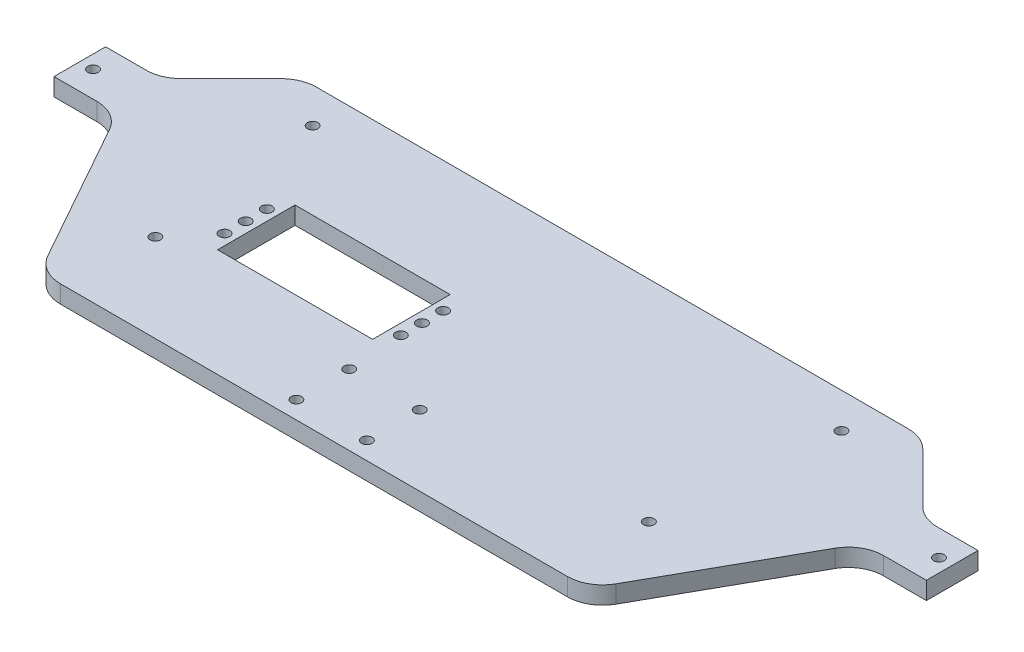
from build123d import *

# Parameters (mm, degrees)
SALIENTE_EXTRUIR1_DEPTH = 5
REDONDEO1_R             = 10
CROQUIS2_R              = 1.5
CROQUIS2_W              = 42
CROQUIS2_H              = 20
CORTAR_EXTRUIR1_DEPTH   = 135.669558943
CROQUIS3_W              = 4
CROQUIS3_H              = 14.636342218
CORTAR_EXTRUIR2_DEPTH   = 135.669558943
CROQUIS4_W              = 44
CROQUIS4_H              = 22
CORTAR_EXTRUIR3_DEPTH   = 131.881206084


with BuildPart() as part:
    # Croquis1 → Saliente-Extruir1 (new body)
    with BuildSketch(Plane(origin=(0, 0, 0), x_dir=(1, 0, 0), z_dir=(0, 1, 0))):
        Polygon((-88.1, 42.318171109), (88.1, 42.318171109), (108.1, 22.318171109), (127.75, 22.318171109), (127.75, 7.681828891), (105.75, 7.681828891), (77.75, -42.318171109), (-77.75, -42.318171109), (-105.75, 7.681828891), (-127.75, 7.681828891), (-127.75, 22.318171109), (-108.1, 22.318171109), align=None)
    extrude(amount=SALIENTE_EXTRUIR1_DEPTH)

    # Redondeo1
    redondeo1_edges = [part.edges().sort_by_distance(p)[0] for p in [
        (-88.1, 2.5, -42.318171109),
        (88.1, 2.5, -42.318171109),
        (108.1, 2.5, -22.318171109),
        (105.75, 2.5, -7.681828891),
        (77.75, 2.5, 42.318171109),
        (-77.75, 2.5, 42.318171109),
        (-105.75, 2.5, -7.681828891),
        (-108.1, 2.5, -22.318171109),
    ]]
    fillet(redondeo1_edges, radius=REDONDEO1_R)

    # Croquis2 → Cortar-Extruir1 (cut, through all)
    with BuildSketch(Plane(origin=(0, 5, 0), x_dir=(1, 0, 0), z_dir=(0, 1, 0))):
        with Locations(Location((70, -17.318171109, 0), (0, 0, 270))):
            Circle(CROQUIS2_R)
        with Locations(Location((-70, -17.318171109, 0), (0, 0, 270))):
            Circle(CROQUIS2_R)
        with Locations(Location((-119.996067812, 15, 0), (0, 0, 270))):
            Circle(CROQUIS2_R)
        with Locations(Location((119.996067812, 15, 0), (0, 0, 270))):
            Circle(CROQUIS2_R)
        with Locations(Location((-75, 32.318171109, 0), (0, 0, 270))):
            Circle(CROQUIS2_R)
        with Locations(Location((75, 32.318171109, 0), (0, 0, 270))):
            Circle(CROQUIS2_R)
        with Locations(Location((-10, -22.318171109, 0), (0, 0, 270))):
            Circle(CROQUIS2_R)
        with Locations(Location((10, -22.318171109, 0), (0, 0, 270))):
            Circle(CROQUIS2_R)
        with Locations(Location((-10, -37.318171109, 0), (0, 0, 270))):
            Circle(CROQUIS2_R)
        with Locations(Location((10, -37.318171109, 0), (0, 0, 270))):
            Circle(CROQUIS2_R)
        with Locations(Location((-61, -0.681828891, 0), (0, 0, 270))):
            Circle(CROQUIS2_R)
        with Locations(Location((-11, -0.681828891, 0), (0, 0, 270))):
            Circle(CROQUIS2_R)
        with Locations(Location((-61, 5.318171109, 0), (0, 0, 270))):
            Circle(CROQUIS2_R)
        with Locations(Location((-61, -6.681828891, 0), (0, 0, 270))):
            Circle(CROQUIS2_R)
        with Locations(Location((-11, 5.318171109, 0), (0, 0, 270))):
            Circle(CROQUIS2_R)
        with Locations(Location((-11, -6.681828891, 0), (0, 0, 270))):
            Circle(CROQUIS2_R)
        with Locations((-36, -0.681828891)):
            Rectangle(CROQUIS2_W, CROQUIS2_H)
    extrude(amount=-CORTAR_EXTRUIR1_DEPTH, mode=Mode.SUBTRACT)

    # Croquis3 → Cortar-Extruir2 (cut, through all)
    with BuildSketch(Plane(origin=(0, 5, 0), x_dir=(1, 0, 0), z_dir=(0, 1, 0))):
        with Locations((-125.75, 15)):
            Rectangle(CROQUIS3_W, CROQUIS3_H)
        with Locations((125.75, 15)):
            Rectangle(CROQUIS3_W, CROQUIS3_H)
    extrude(amount=-CORTAR_EXTRUIR2_DEPTH, mode=Mode.SUBTRACT)

    # Croquis4 → Cortar-Extruir3 (cut, through all)
    with BuildSketch(Plane(origin=(0, 5, 0), x_dir=(1, 0, 0), z_dir=(0, 1, 0))):
        with Locations((-36, -0.681828891)):
            Rectangle(CROQUIS4_W, CROQUIS4_H)
    extrude(amount=-CORTAR_EXTRUIR3_DEPTH, mode=Mode.SUBTRACT)


solid = part.part
